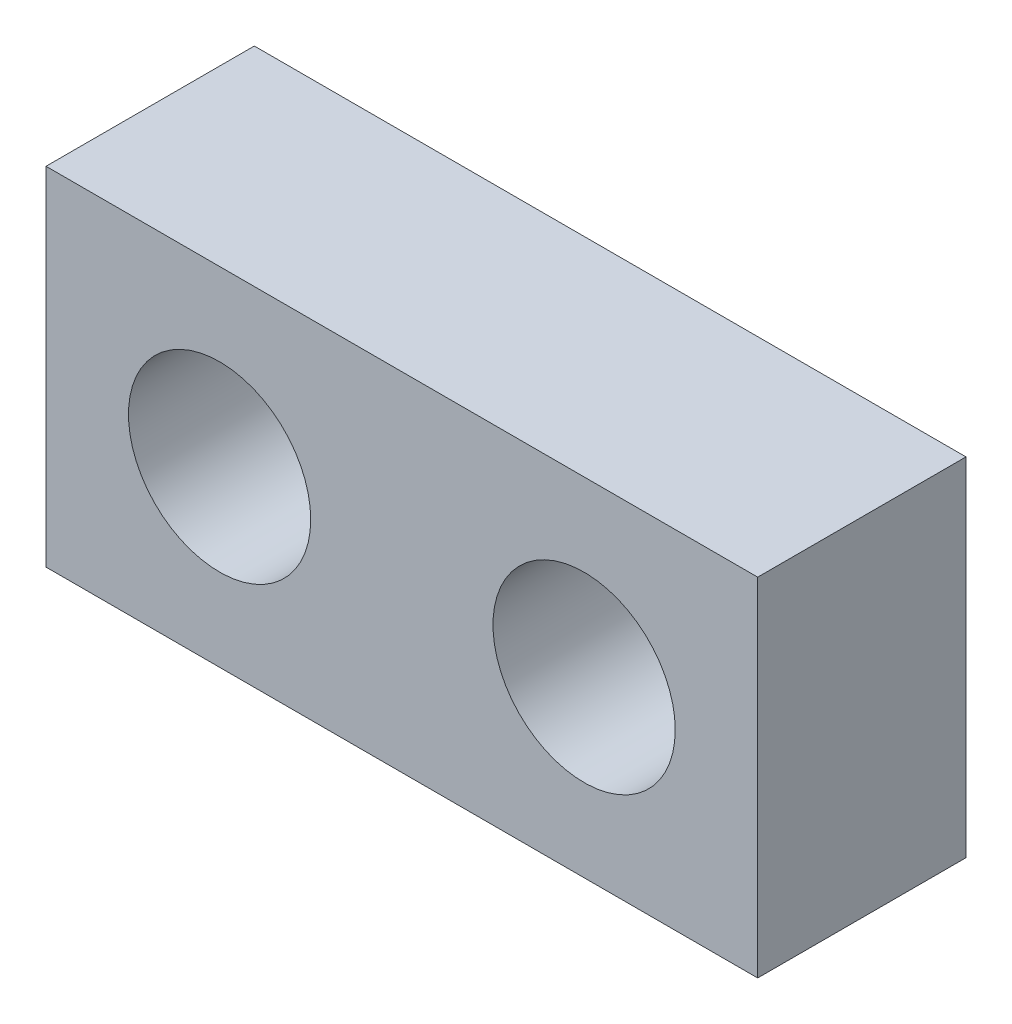
from build123d import *

# Parameters (mm, degrees)
MAINBODY_EXTRUDE_START                 = -3
PROJECTIONXY_SKETCH_W                  = 20.5
PROJECTIONXY_SKETCH_H                  = 10
MAINBODY_EXTRUDE_DEPTH                 = 6
VISESCREWCLEARANCEHOLES_CUT_DEPTH      = 12.792476415
VISESCREWCLEARANCEHOLES_CUT_DEPTH_BACK = 12.792476415
VISESCREWCLEARANCEHOLES_SKETCH_R       = 2.625


with BuildPart() as part:
    # projectionXy_sketch → mainBody_extrude (new body)
    with BuildSketch(Plane.XY.offset(MAINBODY_EXTRUDE_START)):
        Rectangle(PROJECTIONXY_SKETCH_W, PROJECTIONXY_SKETCH_H)
    extrude(amount=MAINBODY_EXTRUDE_DEPTH)

    # viseScrewClearanceHoles_sketch → viseScrewClearanceHoles_cut (cut, two sides: drawn at the far end of the back side and taken through both)
    with BuildSketch(Plane.XY.offset(-VISESCREWCLEARANCEHOLES_CUT_DEPTH_BACK)):
        with Locations((-5.25, 0)):
            Circle(VISESCREWCLEARANCEHOLES_SKETCH_R)
        with Locations((5.25, 0)):
            Circle(VISESCREWCLEARANCEHOLES_SKETCH_R)
    extrude(amount=VISESCREWCLEARANCEHOLES_CUT_DEPTH + VISESCREWCLEARANCEHOLES_CUT_DEPTH_BACK, mode=Mode.SUBTRACT)


solid = part.part
